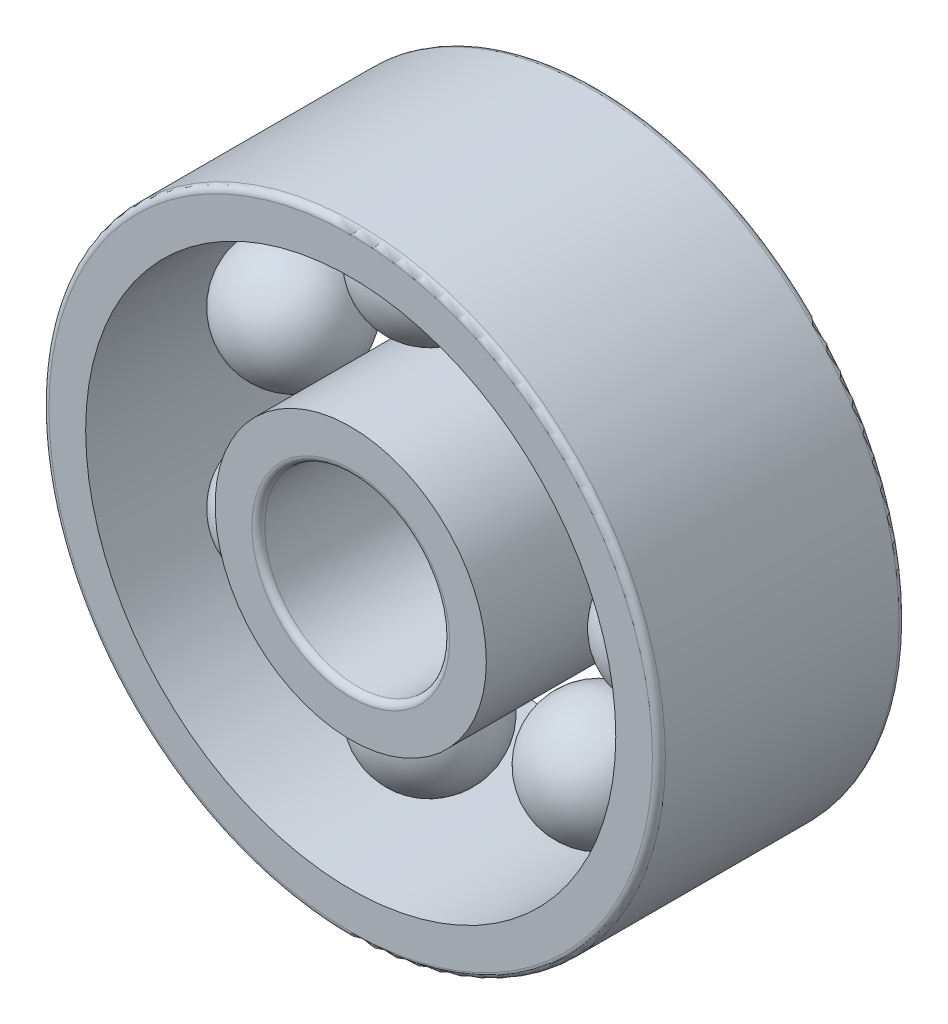
from build123d import *

# Parameters (mm, degrees)
INNERS_W           = 0.7
INNERS_H           = 4
OUTERS_W           = 0.7
OUTERS_H           = 4
BALLSPATTERN_COUNT = 7
FILLET_F1_R        = 0.105
FILLET_F2_R        = 0.105


with BuildPart() as part:
    # InnerS → InnerRing (revolve)
    with BuildSketch(Plane(origin=(0, 0, 0), x_dir=(1, 0, 0), z_dir=(0, 1, 0))):
        with Locations((1.85, 0)):
            Rectangle(INNERS_W, INNERS_H)
    revolve(axis=Axis((0, 0, 4), (0, 0, -1)))

    # Fillet F2
    fillet_f2_edges = [part.edges().sort_by_distance(p)[0] for p in [
        (-1.5, 0, -2),
        (-1.5, 0, 2),
    ]]
    fillet(fillet_f2_edges, radius=FILLET_F2_R)


with BuildPart() as body_2:
    # OuterS → OuterRing (revolve)
    with BuildSketch(Plane(origin=(0, 0, 0), x_dir=(1, 0, 0), z_dir=(0, 1, 0))):
        with Locations((4.65, 0)):
            Rectangle(OUTERS_W, OUTERS_H)
    revolve(axis=Axis((0, 0, 4), (0, 0, -1)))

    # Fillet F1
    fillet_f1_edges = [body_2.edges().sort_by_distance(p)[0] for p in [
        (-5, 0, -2),
        (-5, 0, 2),
    ]]
    fillet(fillet_f1_edges, radius=FILLET_F1_R)


with BuildPart() as body_3:
    # BallS → Ball (revolve)
    with BuildSketch(Plane(origin=(0, 0, 0), x_dir=(1, 0, 0), z_dir=(0, 1, 0))):
        with BuildLine():
            Line((2.2525, 0), (4.2475, 0))
            ThreePointArc((4.2475, 0), (3.25, -0.9975), (2.2525, 0))
        make_face()
    revolve(axis=Axis((2.2525, 0, 0), (1, 0, 0)))


with BuildPart() as ballspattern_1:
    # BallsPattern: pattern copy
    add(body_3.part.rotate(Axis((0, 0, 0), (0, 0, 1)), 1 * 360 / BALLSPATTERN_COUNT))


with BuildPart() as ballspattern_2:
    # BallsPattern: pattern copy
    add(body_3.part.rotate(Axis((0, 0, 0), (0, 0, 1)), 2 * 360 / BALLSPATTERN_COUNT))


with BuildPart() as ballspattern_3:
    # BallsPattern: pattern copy
    add(body_3.part.rotate(Axis((0, 0, 0), (0, 0, 1)), 3 * 360 / BALLSPATTERN_COUNT))


with BuildPart() as ballspattern_4:
    # BallsPattern: pattern copy
    add(body_3.part.rotate(Axis((0, 0, 0), (0, 0, 1)), 4 * 360 / BALLSPATTERN_COUNT))


with BuildPart() as ballspattern_5:
    # BallsPattern: pattern copy
    add(body_3.part.rotate(Axis((0, 0, 0), (0, 0, 1)), 5 * 360 / BALLSPATTERN_COUNT))


with BuildPart() as ballspattern_6:
    # BallsPattern: pattern copy
    add(body_3.part.rotate(Axis((0, 0, 0), (0, 0, 1)), 6 * 360 / BALLSPATTERN_COUNT))


solid = Compound([part.part, body_2.part, body_3.part, ballspattern_1.part, ballspattern_2.part, ballspattern_3.part, ballspattern_4.part, ballspattern_5.part, ballspattern_6.part])
